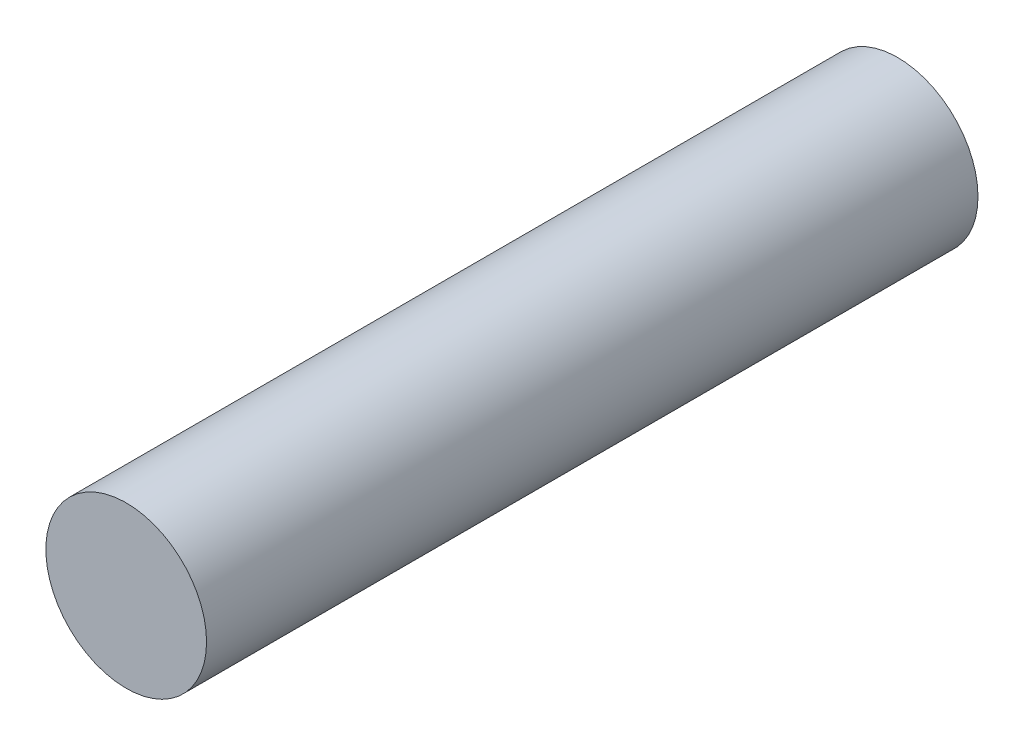
from build123d import *

# Parameters (mm, degrees)
SKETCH2_R           = 2.5
BOSS_EXTRUDE1_DEPTH = 24


with BuildPart() as part:
    # Sketch2 → Boss-Extrude1 (new body)
    with BuildSketch(Plane.XY):
        Circle(SKETCH2_R)
    extrude(amount=BOSS_EXTRUDE1_DEPTH)


solid = part.part
